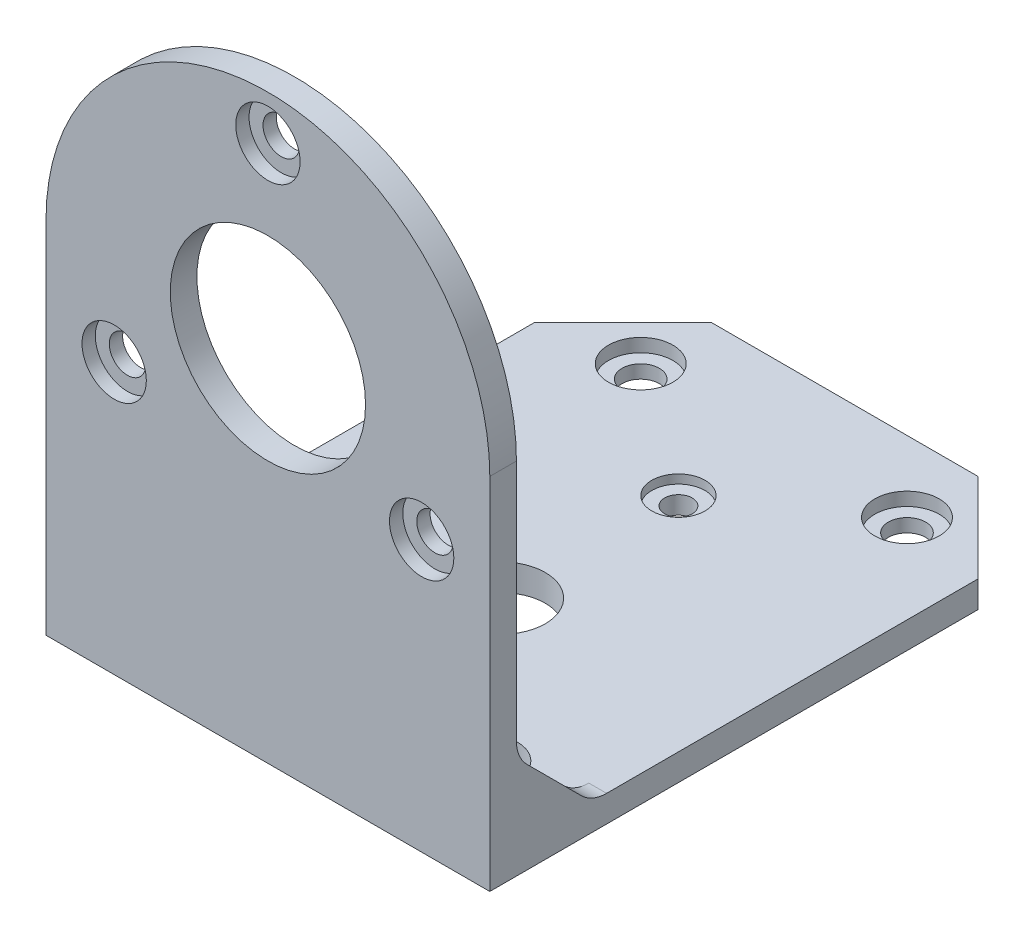
from build123d import *

# Parameters (mm, degrees)
SKETCH_1_R             = 25
SKETCH_1_R_2           = 11
SKETCH_1_R_3           = 2.05
EXTRUDE_1_DEPTH        = 1.5
EXTRUDE_START          = -3
EXTRUDE_2_DEPTH        = 3
SKETCH_4_W             = 50
SKETCH_4_H             = 3
EXTRUDE_3_DEPTH        = 65
CUT_EXTRUDE_1_DEPTH    = 55
SKETCH_7_R             = 2.1
CUT_EXTRUDE_2_DEPTH    = 55
SKETCH_9_R             = 3.625
CUT_EXTRUDE_3_DEPTH    = 1.5
CUT_EXTRUDE_START      = -1.5
SKETCH_11_R            = 3.625
SKETCH_11_R_2          = 2.05
CUT_EXTRUDE_4_DEPTH    = 1.5
SKETCH_12_R            = 1.55
SKETCH_12_R_2          = 5
CUT_EXTRUDE_5_DEPTH    = 6.5
CUT_EXTRUDE_START_2    = -1
SKETCH_13_R            = 3
SKETCH_13_R_2          = 1.55
CUT_EXTRUDE_13_DEPTH   = 1
EXTRUDE_4_DEPTH        = 2
FILLET_1_R             = 4
FILLET_1_OF_MIRROR_1_R = 4


with BuildPart() as part:
    # 草图1 → 凸台-拉伸1 (new, symmetric)
    with BuildSketch(Plane.XY):
        with Locations((0, 90)):
            Circle(SKETCH_1_R)
        with Locations((0, 90)):
            Circle(SKETCH_1_R_2, mode=Mode.SUBTRACT)
        with Locations((0, 110)):
            Circle(SKETCH_1_R_3, mode=Mode.SUBTRACT)
        with Locations((17.320508076, 80)):
            Circle(SKETCH_1_R_3, mode=Mode.SUBTRACT)
        with Locations((-17.320508076, 80)):
            Circle(SKETCH_1_R_3, mode=Mode.SUBTRACT)
    extrude(amount=EXTRUDE_1_DEPTH, both=True)

    # 草图3 → 凸台-拉伸2 (add)
    with BuildSketch(Plane(origin=(0, 0, -1.5), x_dir=(-1, 0, 0), z_dir=(0, 0, -1)).offset(EXTRUDE_START)):
        with BuildLine():
            ThreePointArc((25, 90), (0, 65), (-25, 90))
            Line((-25, 90), (-25, 52.5))
            Line((-25, 52.5), (25, 52.5))
            Line((25, 52.5), (25, 90))
        make_face()
    extrude(amount=EXTRUDE_2_DEPTH)

    # 草图4 → 凸台-拉伸3 (add)
    with BuildSketch(Plane.XY.offset(1.5)):
        with Locations((0, 51)):
            Rectangle(SKETCH_4_W, SKETCH_4_H)
    extrude(amount=-EXTRUDE_3_DEPTH)

    # 草图6 → 切除-拉伸1 (cut)
    with BuildSketch(Plane(origin=(0, 52.5, 0), x_dir=(1, 0, 0), z_dir=(0, 1, 0))):
        Polygon((-25, 53.5), (-15, 63.5), (-25, 63.5), align=None)
        Polygon((25, 63.5), (15, 63.5), (25, 53.5), align=None)
    extrude(amount=-CUT_EXTRUDE_1_DEPTH, mode=Mode.SUBTRACT)

    # 草图7 → 切除-拉伸2 (cut)
    with BuildSketch(Plane(origin=(0, 52.5, 0), x_dir=(1, 0, 0), z_dir=(0, 1, 0))):
        with Locations(Location((-15, 55.5, 0), (0, 0, 270))):
            Circle(SKETCH_7_R)
        with Locations(Location((15, 55.5, 0), (0, 0, 270))):
            Circle(SKETCH_7_R)
        with Locations(Location((15, 8, 0), (0, 0, 270))):
            Circle(SKETCH_7_R)
        with Locations(Location((-15, 8, 0), (0, 0, 270))):
            Circle(SKETCH_7_R)
    extrude(amount=-CUT_EXTRUDE_2_DEPTH, mode=Mode.SUBTRACT)

    # 草图9 → 切除-拉伸3 (cut)
    with BuildSketch(Plane(origin=(0, 52.5, 0), x_dir=(1, 0, 0), z_dir=(0, 1, 0))):
        with Locations(Location((-15, 55.5, 0), (0, 0, 270))):
            Circle(SKETCH_9_R)
        with Locations(Location((15, 55.5, 0), (0, 0, 270))):
            Circle(SKETCH_9_R)
        with Locations(Location((15, 8, 0), (0, 0, 270))):
            Circle(SKETCH_9_R)
        with Locations(Location((-15, 8, 0), (0, 0, 270))):
            Circle(SKETCH_9_R)
    extrude(amount=-CUT_EXTRUDE_3_DEPTH, mode=Mode.SUBTRACT)

    # 草图11 → 切除-拉伸4 (cut)
    # profile 1 of 3: a face of its own
    with BuildSketch(Plane.XY.offset(1.5).offset(CUT_EXTRUDE_START)):
        with Locations((0, 110)):
            Circle(SKETCH_11_R)
        with Locations((0, 110)):
            Circle(SKETCH_11_R_2, mode=Mode.SUBTRACT)
    # profile 2 of 3: a face of its own
    with BuildSketch(Plane.XY.offset(1.5).offset(CUT_EXTRUDE_START)):
        with Locations((17.320508076, 80)):
            Circle(SKETCH_11_R)
        with Locations((17.320508076, 80)):
            Circle(SKETCH_11_R_2, mode=Mode.SUBTRACT)
    # profile 3 of 3: a face of its own
    with BuildSketch(Plane.XY.offset(1.5).offset(CUT_EXTRUDE_START)):
        with Locations((-17.320508076, 80)):
            Circle(SKETCH_11_R)
        with Locations((-17.320508076, 80)):
            Circle(SKETCH_11_R_2, mode=Mode.SUBTRACT)
    extrude(amount=CUT_EXTRUDE_4_DEPTH, mode=Mode.SUBTRACT)

    # 草图12 → 切除-拉伸5 (cut)
    with BuildSketch(Plane.XZ.offset(-49.5)):
        with Locations((0, -4.75)):
            Circle(SKETCH_12_R)
        with Locations((0, -44.75)):
            Circle(SKETCH_12_R)
        with Locations((0, -24.75)):
            Circle(SKETCH_12_R_2)
    extrude(amount=-CUT_EXTRUDE_5_DEPTH, mode=Mode.SUBTRACT)

    # 草图13 → 切除-拉伸13 (cut)
    # profile 1 of 2: a face of its own
    with BuildSketch(Plane(origin=(0, 52.5, 0), x_dir=(1, 0, 0), z_dir=(0, 1, 0)).offset(CUT_EXTRUDE_START_2)):
        with Locations(Location((0, 4.75, 0), (0, 0, 270))):
            Circle(SKETCH_13_R)
        with Locations((0, 4.75)):
            Circle(SKETCH_13_R_2, mode=Mode.SUBTRACT)
    # profile 2 of 2: a face of its own
    with BuildSketch(Plane(origin=(0, 52.5, 0), x_dir=(1, 0, 0), z_dir=(0, 1, 0)).offset(CUT_EXTRUDE_START_2)):
        with Locations(Location((0, 44.75, 0), (0, 0, 270))):
            Circle(SKETCH_13_R)
        with Locations((0, 44.75)):
            Circle(SKETCH_13_R_2, mode=Mode.SUBTRACT)
    extrude(amount=CUT_EXTRUDE_13_DEPTH, mode=Mode.SUBTRACT)

    # 草图14 → 凸台-拉伸4 (add)
    with BuildSketch(Plane(origin=(25, 0, 0), x_dir=(0, 0, -1), z_dir=(1, 0, 0))):
        Polygon((1.5, 61), (10, 52.5), (1.5, 52.5), align=None)
    extrude_4 = extrude(amount=-EXTRUDE_4_DEPTH)

    # 圆角1
    fillet_1_edges = [part.edges().sort_by_distance(p)[0] for p in [
        (24, 61, -1.5),
        (24, 52.5, -10),
    ]]
    fillet(fillet_1_edges, radius=FILLET_1_R)

    # 镜向1: 凸台-拉伸4 across plane
    add(extrude_4.mirror(Plane(origin=(0, 0, 0), x_dir=(0, 0, 1), z_dir=(1, 0, 0))))

    # 圆角1 of 镜向1
    fillet_1_of_mirror_1_edges = [part.edges().sort_by_distance(p)[0] for p in [
        (-24, 61, -1.5),
        (-24, 52.5, -10),
    ]]
    fillet(fillet_1_of_mirror_1_edges, radius=FILLET_1_OF_MIRROR_1_R)


solid = part.part
